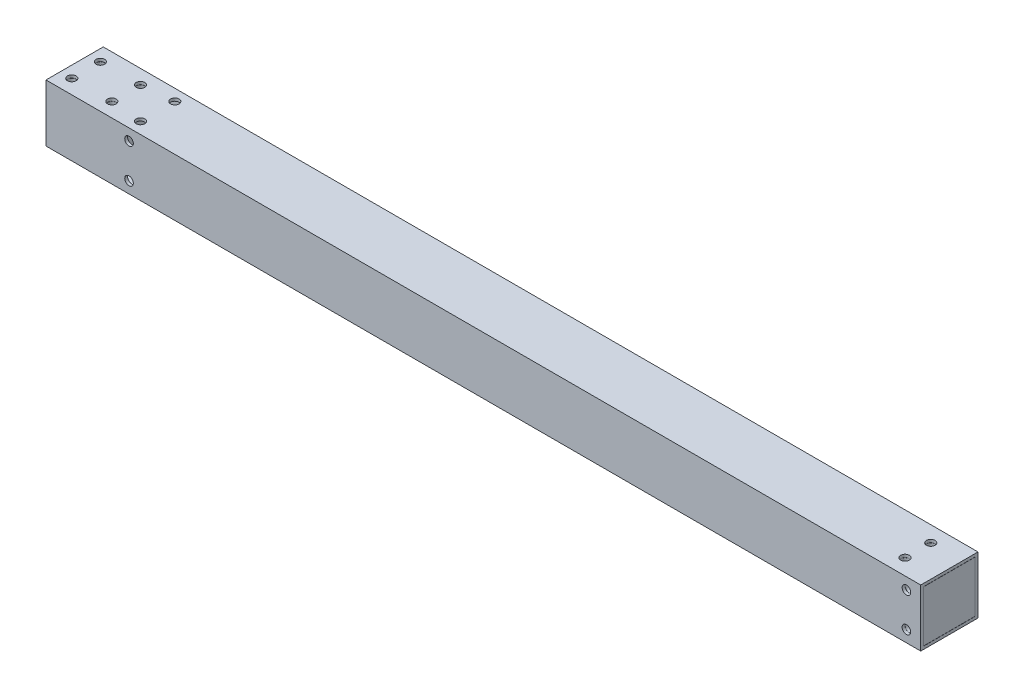
from build123d import *

# Parameters (mm, degrees)
SKETCH_11_W         = 20
SKETCH_11_H         = 20
SKETCH_11_W_2       = 18
SKETCH_11_H_2       = 18
F_20X20X1_1_DEPTH   = 305.54
SKETCH_12_W         = 17.9
SKETCH_12_H         = 17.9
EXTRUDE_1_DEPTH     = 20
SKETCH_13_W         = 17.9
SKETCH_13_H         = 17.9
EXTRUDE_2_DEPTH     = 20
SKETCH_14_R         = 1.5
CUT_EXTRUDE_1_DEPTH = 307.357130813
SKETCH_15_R         = 1.5
CUT_EXTRUDE_2_DEPTH = 307.357130813
SKETCH_16_R         = 1.5
CUT_EXTRUDE_3_DEPTH = 307.357130813
SKETCH_17_R         = 1.5
CUT_EXTRUDE_4_DEPTH = 307.357130813
SKETCH_18_R         = 1.5
CUT_EXTRUDE_5_DEPTH = 307.357130813


with BuildPart() as part:
    # 草图11 → 铝管 20X20X1(1) (new body)
    with BuildSketch(Plane(origin=(0, 0, 0), x_dir=(0, 0, -1), z_dir=(1, 0, 0))):
        Rectangle(SKETCH_11_W, SKETCH_11_H)
        Rectangle(SKETCH_11_W_2, SKETCH_11_H_2, mode=Mode.SUBTRACT)
    extrude(amount=F_20X20X1_1_DEPTH)


with BuildPart() as body_2:
    # 草图12 → 凸台-拉伸1 (new body)
    with BuildSketch(Plane(origin=(305.54, 0, 0), x_dir=(0, 0, -1), z_dir=(1, 0, 0))):
        Rectangle(SKETCH_12_W, SKETCH_12_H)
    extrude(amount=-EXTRUDE_1_DEPTH)


with BuildPart() as body_3:
    # 草图13 → 凸台-拉伸2 (new body)
    with BuildSketch(Plane.ZY):
        Rectangle(SKETCH_13_W, SKETCH_13_H)
    extrude(amount=-EXTRUDE_2_DEPTH)


with BuildPart() as cut_extrude_1_tool:
    # 草图14 → 切除-拉伸1 (new, through all)
    with BuildSketch(Plane(origin=(0, 10, 0), x_dir=(1, 0, 0), z_dir=(0, 1, 0))):
        with Locations(Location((294.54, 4.5, 0), (0, 0, 270))):
            Circle(SKETCH_14_R)
        with Locations(Location((294.54, -4.5, 0), (0, 0, 270))):
            Circle(SKETCH_14_R)
    extrude(amount=-CUT_EXTRUDE_1_DEPTH)


with BuildPart() as part_1:
    add(part.part)

    # 切除-拉伸1: cut by cut_extrude_1_tool
    add(cut_extrude_1_tool.part, mode=Mode.SUBTRACT)


with BuildPart() as body_2_1:
    add(body_2.part)

    # 切除-拉伸1: cut by cut_extrude_1_tool
    add(cut_extrude_1_tool.part, mode=Mode.SUBTRACT)


with BuildPart() as cut_extrude_2_tool:
    # 草图15 → 切除-拉伸2 (new, through all)
    with BuildSketch(Plane(origin=(0, 10, 0), x_dir=(1, 0, 0), z_dir=(0, 1, 0))):
        with Locations(Location((4, 5, 0), (0, 0, 270))):
            Circle(SKETCH_15_R)
        with Locations(Location((4, -5, 0), (0, 0, 270))):
            Circle(SKETCH_15_R)
        with Locations(Location((18, 5, 0), (0, 0, 270))):
            Circle(SKETCH_15_R)
        with Locations(Location((18, -5, 0), (0, 0, 270))):
            Circle(SKETCH_15_R)
    extrude(amount=-CUT_EXTRUDE_2_DEPTH)


with BuildPart() as part_2:
    add(part_1.part)

    # 切除-拉伸2: cut by cut_extrude_2_tool
    add(cut_extrude_2_tool.part, mode=Mode.SUBTRACT)

    # 草图16 → 切除-拉伸3 (cut, through all)
    with BuildSketch(Plane(origin=(0, 0, 10), x_dir=(1, 0, 0), z_dir=(0, 0, -1))):
        with Locations(Location((29, -6, 0), (0, 0, 180))):
            Circle(SKETCH_16_R)
        with Locations(Location((29, 6, 0), (0, 0, 180))):
            Circle(SKETCH_16_R)
    extrude(amount=CUT_EXTRUDE_3_DEPTH, mode=Mode.SUBTRACT)


with BuildPart() as body_3_1:
    add(body_3.part)

    # 切除-拉伸2: cut by cut_extrude_2_tool
    add(cut_extrude_2_tool.part, mode=Mode.SUBTRACT)


with BuildPart() as cut_extrude_4_tool:
    # 草图17 → 切除-拉伸4 (new, through all)
    with BuildSketch(Plane(origin=(0, 0, -10), x_dir=(-1, 0, 0), z_dir=(0, 0, -1))):
        with Locations((-300.54, 6)):
            Circle(SKETCH_17_R)
        with Locations((-300.54, -6)):
            Circle(SKETCH_17_R)
    extrude(amount=-CUT_EXTRUDE_4_DEPTH)


with BuildPart() as part_3:
    add(part_2.part)

    # 切除-拉伸4: cut by cut_extrude_4_tool
    add(cut_extrude_4_tool.part, mode=Mode.SUBTRACT)

    # 草图18 → 切除-拉伸5 (cut, through all)
    with BuildSketch(Plane(origin=(0, 10, 0), x_dir=(1, 0, 0), z_dir=(0, 1, 0))):
        with Locations(Location((29, 6, 0), (0, 0, 270))):
            Circle(SKETCH_18_R)
        with Locations(Location((29, -6, 0), (0, 0, 270))):
            Circle(SKETCH_18_R)
    extrude(amount=-CUT_EXTRUDE_5_DEPTH, mode=Mode.SUBTRACT)


with BuildPart() as body_2_2:
    add(body_2_1.part)

    # 切除-拉伸4: cut by cut_extrude_4_tool
    add(cut_extrude_4_tool.part, mode=Mode.SUBTRACT)


solid = Compound([body_3_1.part, part_3.part, body_2_2.part])
